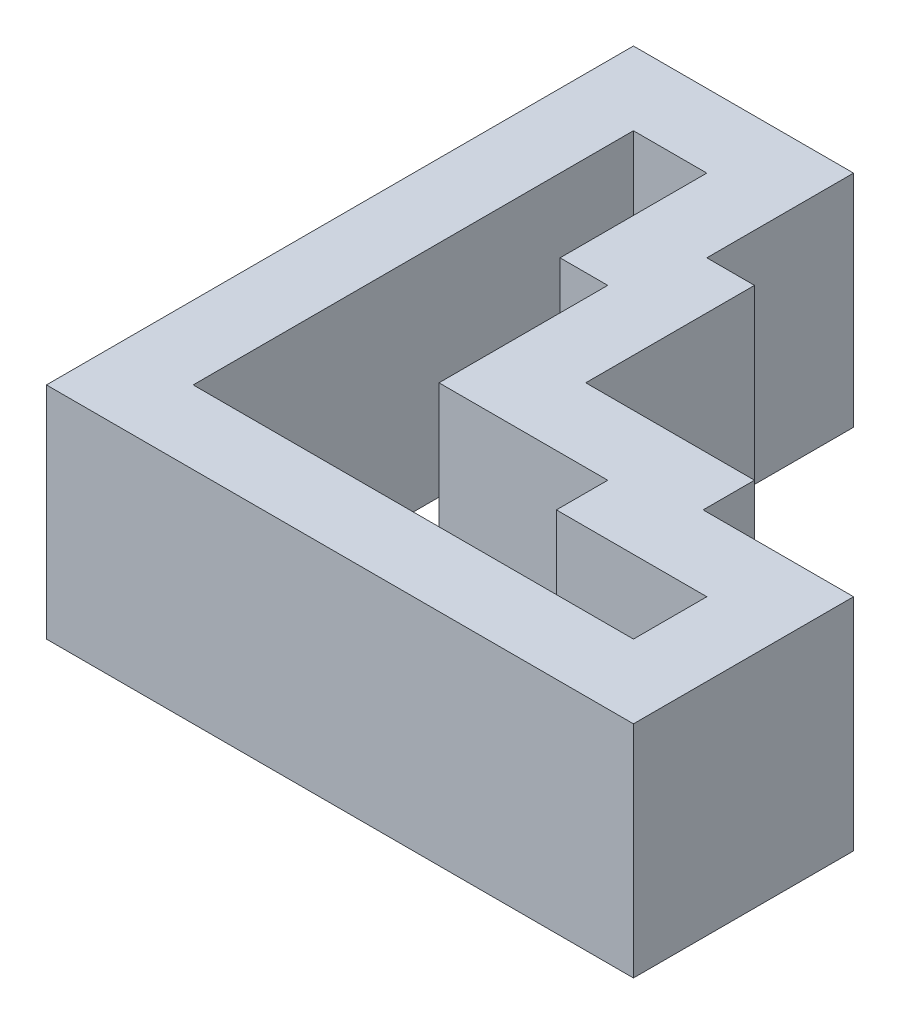
from build123d import *

# Parameters (mm, degrees)
EXTRUDE_1_DEPTH = 30


with BuildPart() as part:
    # 草图1 → 拉伸-薄壁1 (new body)
    with BuildSketch(Plane(origin=(0, 0, 0), x_dir=(1, 0, 0), z_dir=(0, 1, 0))):
        Polygon((-10, -10), (70, -10), (70, 20), (49.5, 20), (49.5, 27), (26.5, 27), (26.5, 50), (20, 50), (20, 70), (-10, 70), align=None)
        Polygon((0, 0), (60, 0), (60, 10), (39.5, 10), (39.5, 17), (16.5, 17), (16.5, 40), (10, 40), (10, 60), (0, 60), align=None, mode=Mode.SUBTRACT)
    extrude(amount=EXTRUDE_1_DEPTH)


solid = part.part
